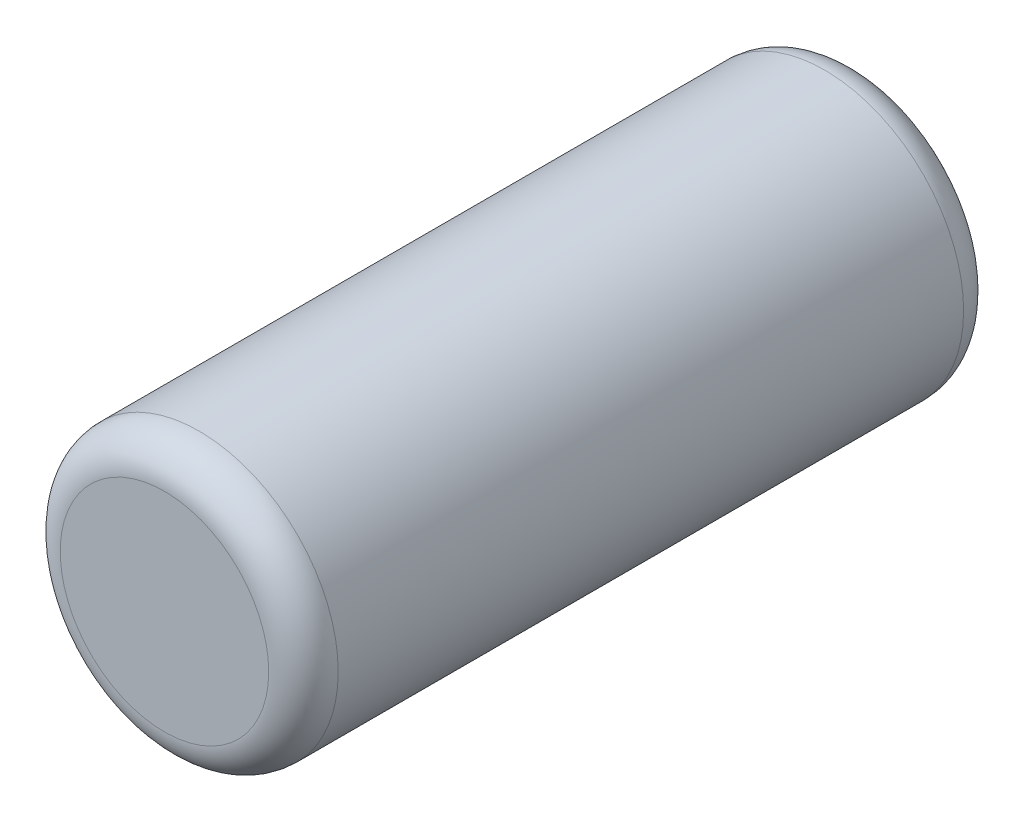
from build123d import *

# Parameters (mm, degrees)
ESQUISSE1_R          = 4
BASE_EXTRUSION_DEPTH = 20
CONG_1_R             = 1


with BuildPart() as part:
    # Esquisse1 → Base-Extrusion (new body)
    with BuildSketch(Plane.XY):
        Circle(ESQUISSE1_R)
    extrude(amount=BASE_EXTRUSION_DEPTH)

    # Congé1
    cong_1_edges = [part.edges().sort_by_distance(p)[0] for p in [
        (-4, 0, 0),
        (-4, 0, 20),
    ]]
    fillet(cong_1_edges, radius=CONG_1_R)


solid = part.part
